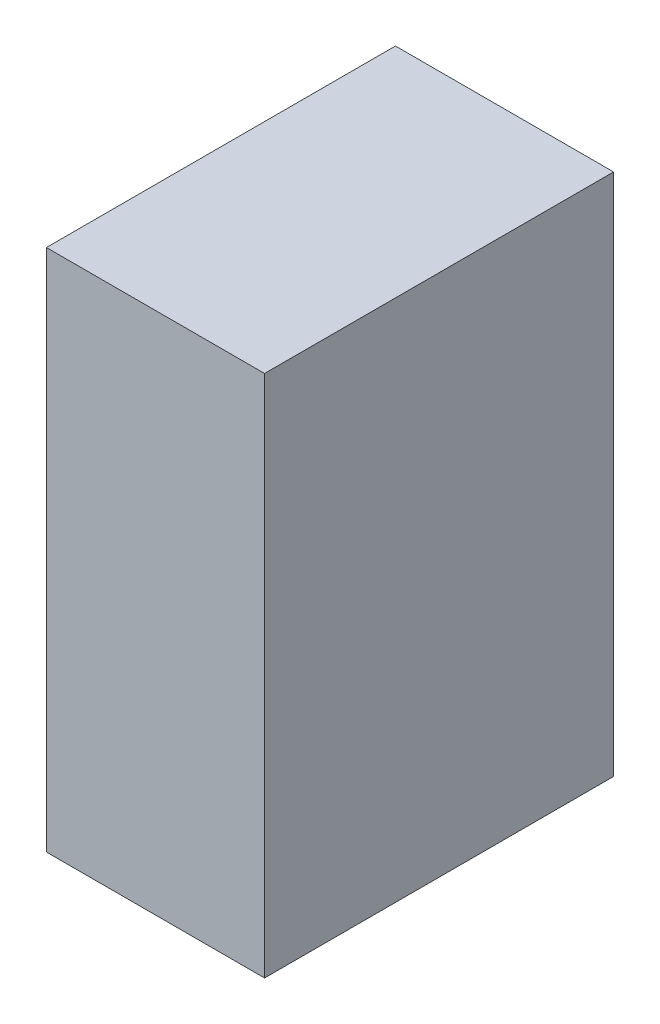
from build123d import *

# Parameters (mm, degrees)
SKETCH1_W           = 0.25
SKETCH1_H           = 0.6
BOSS_EXTRUDE1_DEPTH = 0.4


with BuildPart() as part:
    # Sketch1 → Boss-Extrude1 (new body)
    with BuildSketch(Plane.XY):
        with Locations((0.125, 0.3)):
            Rectangle(SKETCH1_W, SKETCH1_H)
    extrude(amount=BOSS_EXTRUDE1_DEPTH)


solid = part.part
